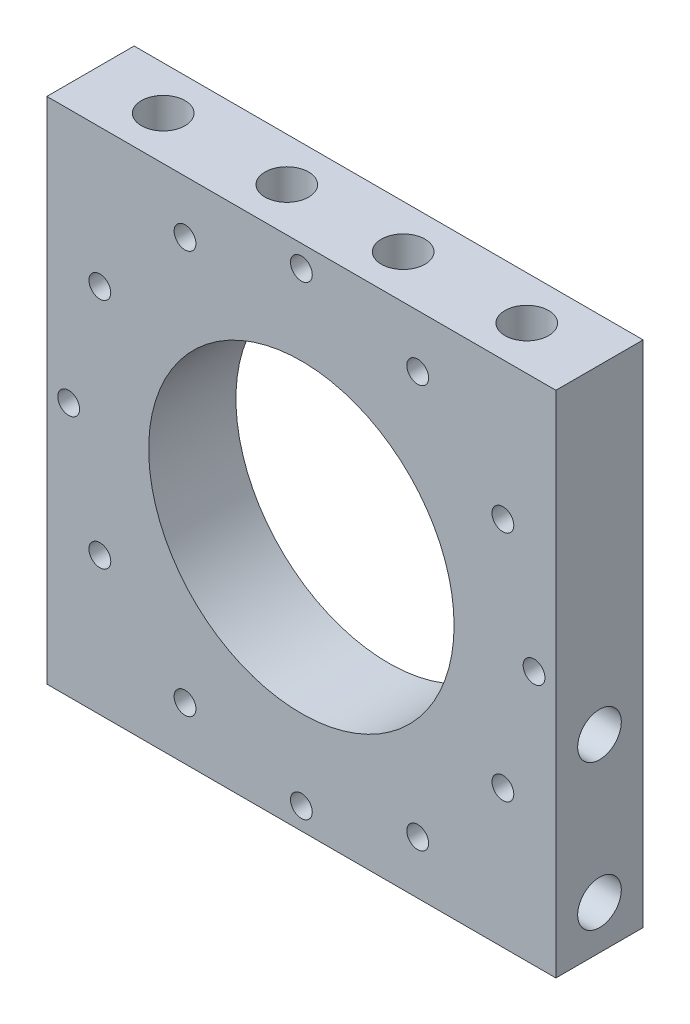
from build123d import *

# Parameters (mm, degrees)
SKETCH_1_W          = 70
SKETCH_1_H          = 70
SKETCH_1_R          = 1.5
SKETCH_1_R_2        = 21
EXTRUDE_1_DEPTH     = 12
SKETCH_3_R          = 3
CUT_EXTRUDE_2_DEPTH = 10
SKETCH_4_R          = 3
CUT_EXTRUDE_3_DEPTH = 10
CUT_EXTRUDE_START   = -10
SKETCH_5_R          = 3
CUT_EXTRUDE_4_DEPTH = 10
SKETCH_6_R          = 3
CUT_EXTRUDE_5_DEPTH = 10


with BuildPart() as part:
    # 草图1 → 凸台-拉伸1 (new body)
    with BuildSketch(Plane.XY):
        Rectangle(SKETCH_1_W, SKETCH_1_H)
        with Locations((32, 0)):
            Circle(SKETCH_1_R, mode=Mode.SUBTRACT)
        with Locations((27.712812921, -16)):
            Circle(SKETCH_1_R, mode=Mode.SUBTRACT)
        with Locations((16, -27.712812921)):
            Circle(SKETCH_1_R, mode=Mode.SUBTRACT)
        with Locations((0, -32)):
            Circle(SKETCH_1_R, mode=Mode.SUBTRACT)
        with Locations((-16, -27.712812921)):
            Circle(SKETCH_1_R, mode=Mode.SUBTRACT)
        with Locations((-27.712812921, -16)):
            Circle(SKETCH_1_R, mode=Mode.SUBTRACT)
        with Locations((-32, 0)):
            Circle(SKETCH_1_R, mode=Mode.SUBTRACT)
        with Locations((-27.712812921, 16)):
            Circle(SKETCH_1_R, mode=Mode.SUBTRACT)
        with Locations((-16, 27.712812921)):
            Circle(SKETCH_1_R, mode=Mode.SUBTRACT)
        with Locations((0, 32)):
            Circle(SKETCH_1_R, mode=Mode.SUBTRACT)
        with Locations((16, 27.712812921)):
            Circle(SKETCH_1_R, mode=Mode.SUBTRACT)
        with Locations((27.712812921, 16)):
            Circle(SKETCH_1_R, mode=Mode.SUBTRACT)
        Circle(SKETCH_1_R_2, mode=Mode.SUBTRACT)
    extrude(amount=EXTRUDE_1_DEPTH)

    # 草图3 → 切除-拉伸2 (cut)
    with BuildSketch(Plane(origin=(0, 35, 0), x_dir=(1, 0, 0), z_dir=(0, 1, 0))):
        with Locations(Location((-25, -6, 0), (0, 0, 270))):
            Circle(SKETCH_3_R)
        with Locations(Location((-8, -6, 0), (0, 0, 270))):
            Circle(SKETCH_3_R)
        with Locations(Location((25, -6, 0), (0, 0, 90))):
            Circle(SKETCH_3_R)
        with Locations(Location((8, -6, 0), (0, 0, 90))):
            Circle(SKETCH_3_R)
    extrude(amount=-CUT_EXTRUDE_2_DEPTH, mode=Mode.SUBTRACT)

    # 草图4 → 切除-拉伸3 (cut)
    with BuildSketch(Plane(origin=(35, 0, 0), x_dir=(0, 0, -1), z_dir=(1, 0, 0))):
        with Locations((-6, -9)):
            Circle(SKETCH_4_R)
        with Locations((-6, -29)):
            Circle(SKETCH_4_R)
    extrude(amount=-CUT_EXTRUDE_3_DEPTH, mode=Mode.SUBTRACT)

    # 草图5 → 切除-拉伸4 (cut)
    with BuildSketch(Plane.ZY.offset(35).offset(CUT_EXTRUDE_START)):
        with Locations(Location((6, -29, 0), (0, 0, 180))):
            Circle(SKETCH_5_R)
        with Locations(Location((6, -9, 0), (0, 0, 180))):
            Circle(SKETCH_5_R)
    extrude(amount=CUT_EXTRUDE_4_DEPTH, mode=Mode.SUBTRACT)

    # 草图6 → 切除-拉伸5 (cut)
    with BuildSketch(Plane.XZ.offset(35)):
        with Locations(Location((10, 6, 0), (0, 0, 270))):
            Circle(SKETCH_6_R)
        with Locations(Location((-10, 6, 0), (0, 0, 270))):
            Circle(SKETCH_6_R)
    extrude(amount=-CUT_EXTRUDE_5_DEPTH, mode=Mode.SUBTRACT)


solid = part.part
